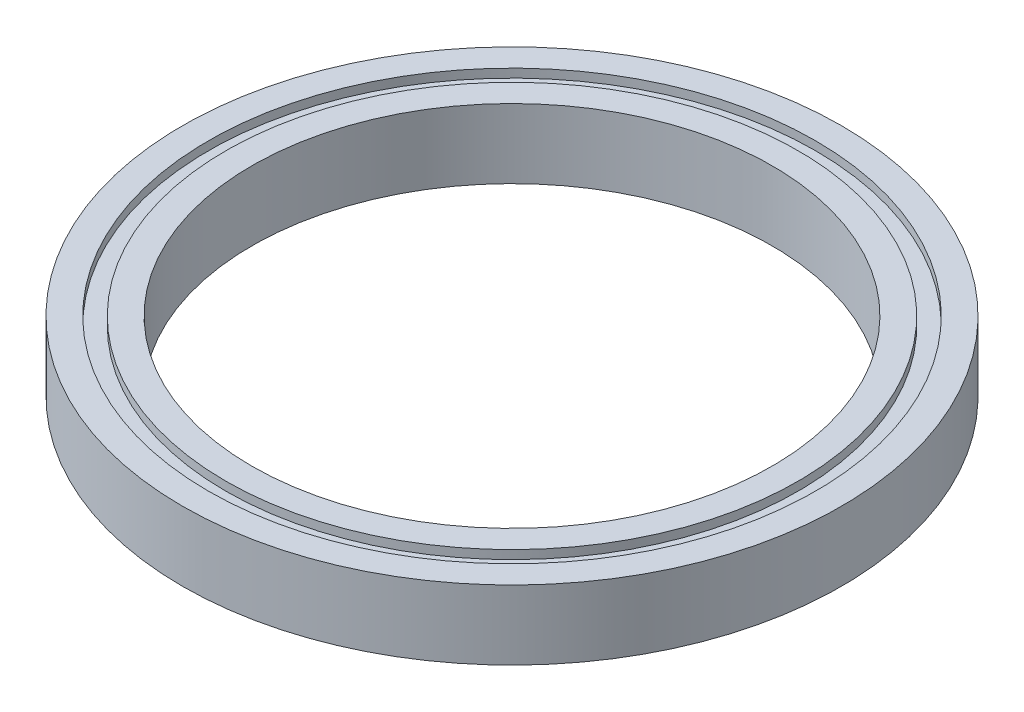
from build123d import *

# Parameters (mm, degrees)
SKETCH_1_R          = 38
SKETCH_1_R_2        = 30
EXTRUDE_1_DEPTH     = 8
SKETCH_2_R          = 35
SKETCH_2_R_2        = 33
CUT_EXTRUDE_1_DEPTH = 1
CUT_EXTRUDE_START   = -1
SKETCH_3_R          = 35
SKETCH_3_R_2        = 33
CUT_EXTRUDE_2_DEPTH = 1


with BuildPart() as part:
    # 草图1 → 凸台-拉伸1 (new body)
    with BuildSketch(Plane(origin=(0, 0, 0), x_dir=(1, 0, 0), z_dir=(0, 1, 0))):
        with Locations(Location((0, 0, 0), (0, 0, 270))):
            Circle(SKETCH_1_R)
        with Locations(Location((0, 0, 0), (0, 0, 270))):
            Circle(SKETCH_1_R_2, mode=Mode.SUBTRACT)
    extrude(amount=EXTRUDE_1_DEPTH)

    # 草图2 → 切除-拉伸1 (cut)
    with BuildSketch(Plane(origin=(0, 8, 0), x_dir=(1, 0, 0), z_dir=(0, 1, 0))):
        with Locations(Location((0, 0, 0), (0, 0, 270))):
            Circle(SKETCH_2_R)
        with Locations(Location((0, 0, 0), (0, 0, 270))):
            Circle(SKETCH_2_R_2, mode=Mode.SUBTRACT)
    extrude(amount=-CUT_EXTRUDE_1_DEPTH, mode=Mode.SUBTRACT)

    # 草图3 → 切除-拉伸2 (cut)
    with BuildSketch(Plane.XZ.offset(CUT_EXTRUDE_START)):
        with Locations(Location((0, 0, 0), (0, 0, 90))):
            Circle(SKETCH_3_R)
        with Locations(Location((0, 0, 0), (0, 0, 90))):
            Circle(SKETCH_3_R_2, mode=Mode.SUBTRACT)
    extrude(amount=CUT_EXTRUDE_2_DEPTH, mode=Mode.SUBTRACT)


solid = part.part
